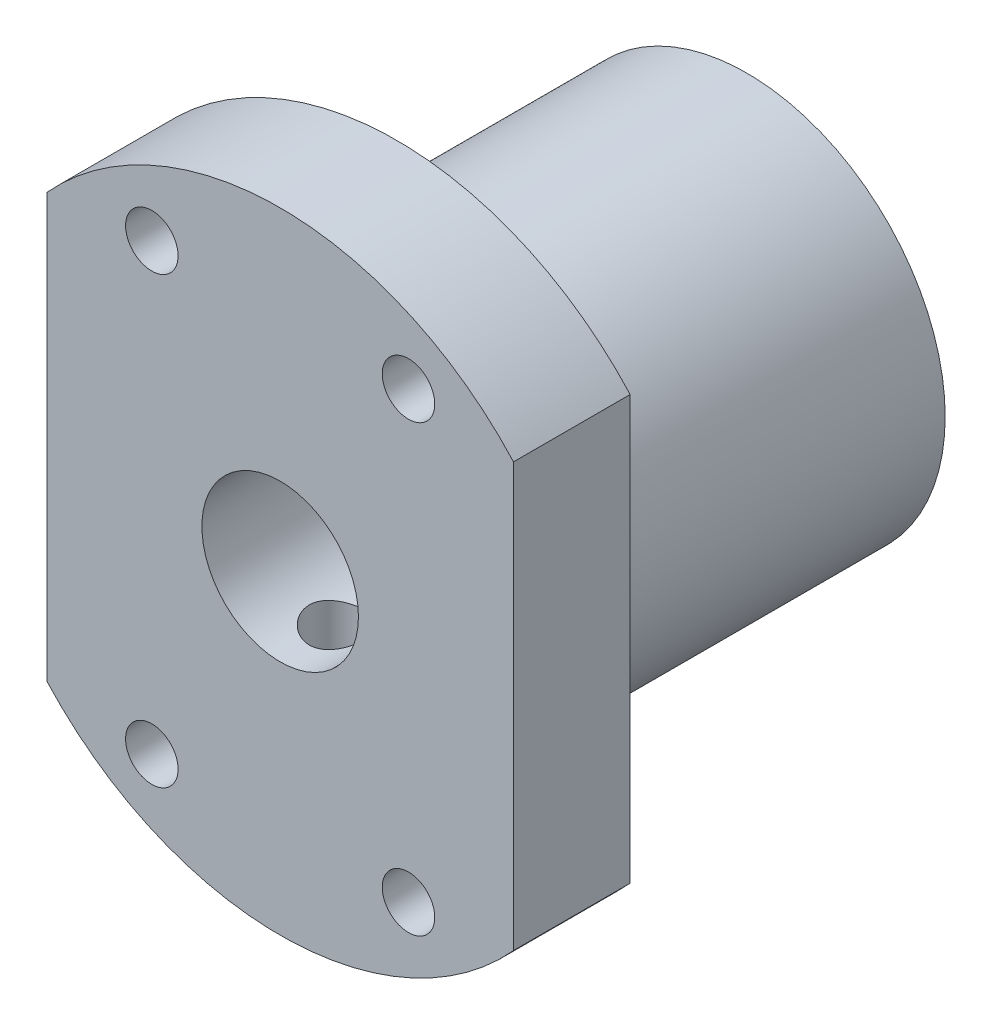
from build123d import *

# Parameters (mm, degrees)
SKETCH1_R                        = 17
BOSS_EXTRUDE1_DEPTH              = 30
BOSS_EXTRUDE2_DEPTH              = 10
SKETCH4_R                        = 6.71
CUT_EXTRUDE1_DEPTH               = 53.239831546
TAP_DRILL_FOR_M6X1_0_TAP1_REACH  = 72.114
TAP_DRILL_FOR_M6X1_0_TAP1_BORE_R = 2.5
F_4_5_4_5_DIAMETER_HOLE1_D       = 4.5


with BuildPart() as part:
    # Sketch1 → Boss-Extrude1 (new body)
    with BuildSketch(Plane.XY):
        Circle(SKETCH1_R)
    extrude(amount=BOSS_EXTRUDE1_DEPTH)

    # Sketch3 → Boss-Extrude2 (add)
    with BuildSketch(Plane.XY.offset(30)):
        with BuildLine():
            Line((-20, -18.138357147), (-20, 18.138357147))
            ThreePointArc((-20, 18.138357147), (0, 27), (20, 18.138357147))
            Line((20, 18.138357147), (20, -18.138357147))
            ThreePointArc((20, -18.138357147), (0, -27), (-20, -18.138357147))
        make_face()
    extrude(amount=BOSS_EXTRUDE2_DEPTH)

    # Sketch4 → Cut-Extrude1 (cut, through all)
    with BuildSketch(Plane.XY.offset(40)):
        Circle(SKETCH4_R)
    extrude(amount=-CUT_EXTRUDE1_DEPTH, mode=Mode.SUBTRACT)

    # Tap Drill for M6x1.0 Tap1 bore → Tap Drill for M6x1.0 Tap1 (cut, up to next)
    with BuildSketch(Plane(origin=(0, -27, 0), x_dir=(-1, 0, 0), z_dir=(0, -1, 0)), mode=Mode.PRIVATE) as tap_drill_for_m6x1_0_tap1_sk1:
        with Locations((0, -35)):
            Circle(TAP_DRILL_FOR_M6X1_0_TAP1_BORE_R)
    tap_drill_for_m6x1_0_tap1_tool1 = extrude(tap_drill_for_m6x1_0_tap1_sk1.sketch, amount=-TAP_DRILL_FOR_M6X1_0_TAP1_REACH, mode=Mode.PRIVATE) & part.part
    add(tap_drill_for_m6x1_0_tap1_tool1.solids().sort_by_distance((0, -27, 35))[0], mode=Mode.SUBTRACT)

    # Ø4.5 (4.5) Diameter Hole1 (through all)
    with Locations(Plane.XY.offset(40)):
        with Locations((-11, -19.052558883), (-11, 19.052558883), (11, 19.052558883), (11, -19.052558883)):
            Hole(F_4_5_4_5_DIAMETER_HOLE1_D / 2)


solid = part.part
